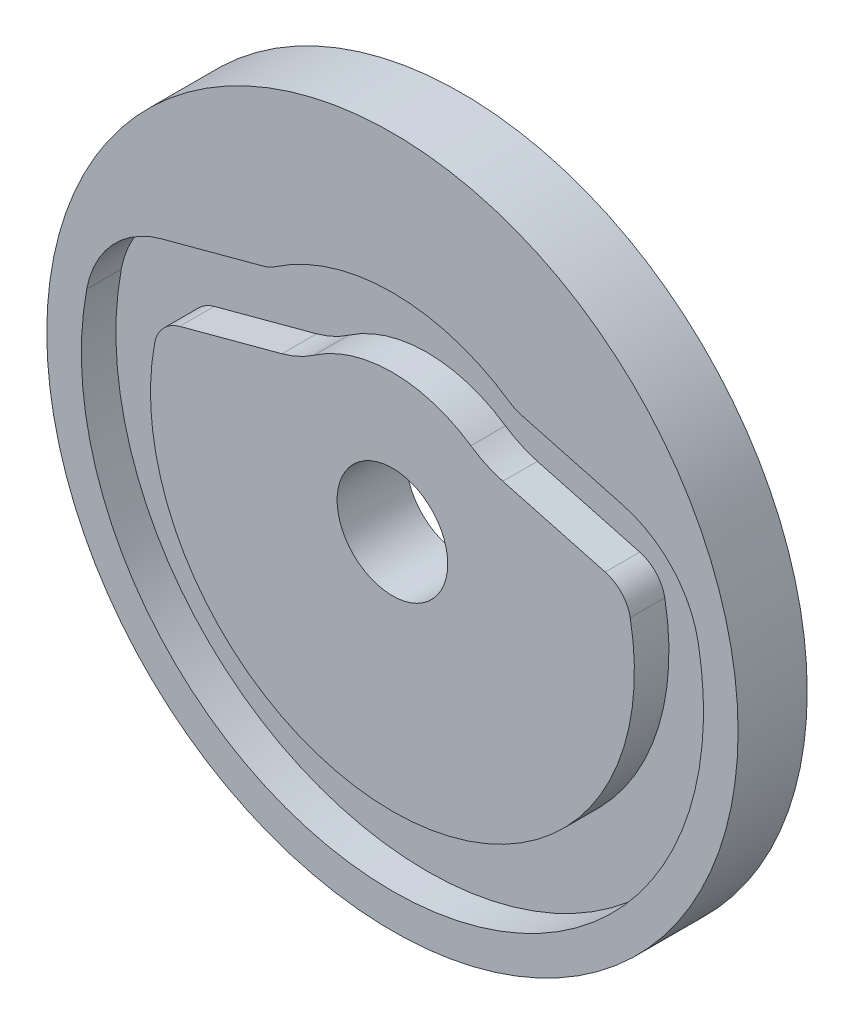
from build123d import *

# Parameters (mm, degrees)
SKETCH_1_R            = 50
EXTRUDE_1_DEPTH       = 10
CUT_EXTRUDE_1_DEPTH   = 5
SKETCH_4_R            = 8
CUT_EXTRUDE_1_2_DEPTH = 72.414284285


with BuildPart() as part:
    # 草图1 → 凸台-拉伸1 (new body)
    with BuildSketch(Plane.XY):
        Circle(SKETCH_1_R)
    extrude(amount=EXTRUDE_1_DEPTH)

    # 草图2 → Cut-Extrude 1 (cut)
    with BuildSketch(Plane.XY.offset(10)):
        with BuildLine():
            ThreePointArc((44.226450487, 8.307892471), (0, -45), (-44.226450487, 8.307892471))
            ThreePointArc((-44.226450487, 8.307892471), (-40.486781839, 15.733956697), (-33.366586001, 20.027482375))
            Line((-33.366586001, 20.027482375), (-18.55842138, 23.995318126))
            ThreePointArc((-18.55842138, 23.995318126), (-17.756990045, 24.285259115), (-17.016442805, 24.70709765))
            ThreePointArc((-17.016442805, 24.70709765), (0, 30), (17.016442805, 24.70709765))
            ThreePointArc((17.016442805, 24.70709765), (17.756990045, 24.285259115), (18.55842138, 23.995318126))
            Line((18.55842138, 23.995318126), (33.366586001, 20.027482375))
            ThreePointArc((33.366586001, 20.027482375), (40.486781839, 15.733956697), (44.226450487, 8.307892471))
        make_face()
        with BuildLine():
            ThreePointArc((34.398350379, 6.461694144), (0, -35), (-34.398350379, 6.461694144))
            ThreePointArc((-34.398350379, 6.461694144), (-33.151794163, 8.937048886), (-30.77839555, 10.368224112))
            Line((-30.77839555, 10.368224112), (-15.970230929, 14.336059864))
            ThreePointArc((-15.970230929, 14.336059864), (-13.565936922, 15.20588283), (-11.344295203, 16.471398433))
            ThreePointArc((-11.344295203, 16.471398433), (0, 20), (11.344295203, 16.471398433))
            ThreePointArc((11.344295203, 16.471398433), (13.565936922, 15.20588283), (15.970230929, 14.336059864))
            Line((15.970230929, 14.336059864), (30.77839555, 10.368224112))
            ThreePointArc((30.77839555, 10.368224112), (33.151794163, 8.937048886), (34.398350379, 6.461694144))
        make_face(mode=Mode.SUBTRACT)
    extrude(amount=-CUT_EXTRUDE_1_DEPTH, mode=Mode.SUBTRACT)

    # 草图4 → Cut-Extrude 1 2 (cut, through all)
    with BuildSketch(Plane.XY.offset(10)):
        Circle(SKETCH_4_R)
    extrude(amount=-CUT_EXTRUDE_1_2_DEPTH, mode=Mode.SUBTRACT)


solid = part.part
